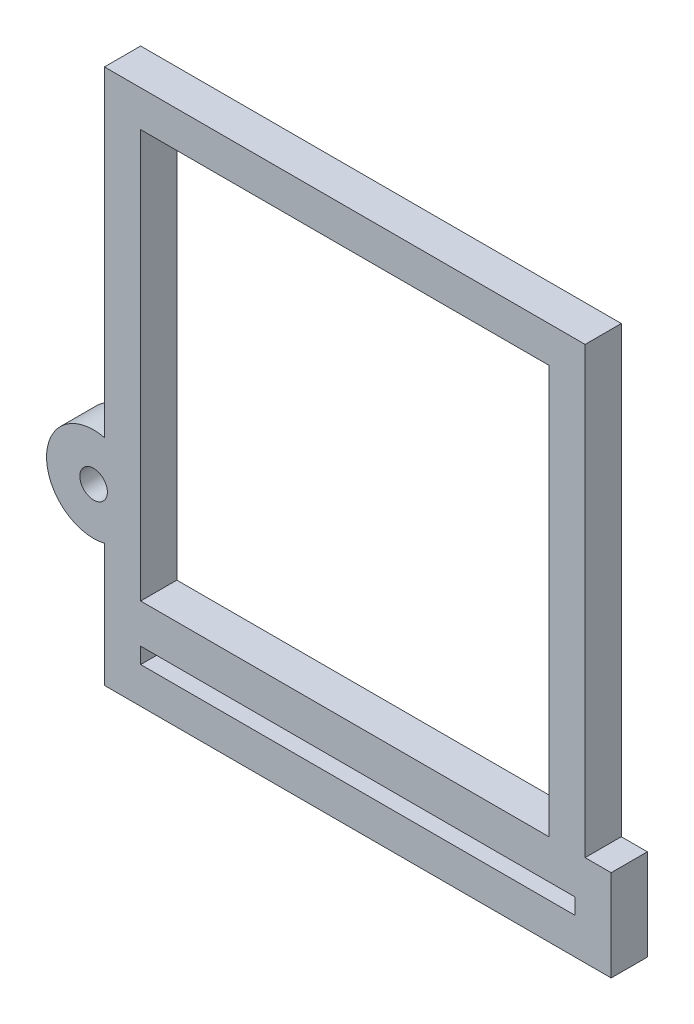
from build123d import *

# Parameters (mm, degrees)
SKETCH_1_W          = 70
SKETCH_1_H          = 74
EXTRUDE_1_DEPTH     = 5
CUT_EXTRUDE_2_REACH = 103.985
SKETCH_2_W          = 60
SKETCH_2_H          = 2.2
SKETCH_3_W          = 56.4
SKETCH_3_H          = 56.4
CUT_EXTRUDE_3_DEPTH = 20
SKETCH_4_W          = 3.6
SKETCH_4_H          = 61.4
CUT_EXTRUDE_5_DEPTH = 102.985293057
SKETCH_5_R          = 6.5
EXTRUDE_6_DEPTH     = 5
CUT_EXTRUDE_7_REACH = 103.985
SKETCH_6_R          = 1.9


with BuildPart() as part:
    # Эскиз1 → Вытянуть1 (new body)
    with BuildSketch(Plane.XY):
        with Locations((35, 37)):
            Rectangle(SKETCH_1_W, SKETCH_1_H)
    extrude(amount=EXTRUDE_1_DEPTH)

    # Эскиз2 → Вытянуть2 (cut, up to next)
    with BuildSketch(Plane.XY.offset(5), mode=Mode.PRIVATE) as cut_extrude_2_sk1:
        with Locations((35, 6.1)):
            Rectangle(SKETCH_2_W, SKETCH_2_H)
    cut_extrude_2_tool1 = extrude(cut_extrude_2_sk1.sketch, amount=-CUT_EXTRUDE_2_REACH, mode=Mode.PRIVATE) & part.part
    add(cut_extrude_2_tool1.solids().sort_by_distance((35, 6.1, 5))[0], mode=Mode.SUBTRACT)

    # Эскиз3 → Вытянуть3 (cut)
    with BuildSketch(Plane.XY.offset(5)):
        with Locations((33.2, 40.8)):
            Rectangle(SKETCH_3_W, SKETCH_3_H)
    extrude(amount=-CUT_EXTRUDE_3_DEPTH, mode=Mode.SUBTRACT)

    # Эскиз4 → Вытянуть5 (cut, through all)
    with BuildSketch(Plane(origin=(0, 0, 0), x_dir=(-1, 0, 0), z_dir=(0, 0, -1))):
        with Locations((-68.2, 43.3)):
            Rectangle(SKETCH_4_W, SKETCH_4_H)
    extrude(amount=-CUT_EXTRUDE_5_DEPTH, mode=Mode.SUBTRACT)

    # Эскиз5 → Вытянуть6 (add)
    with BuildSketch(Plane.XY.offset(5)):
        with Locations((-1.5, 23.329095616)):
            Circle(SKETCH_5_R)
    extrude(amount=-EXTRUDE_6_DEPTH)

    # Эскиз6 → Вытянуть7 (cut, up to next)
    with BuildSketch(Plane.XY.offset(5), mode=Mode.PRIVATE) as cut_extrude_7_sk1:
        with Locations((-1.5, 23.329095616)):
            Circle(SKETCH_6_R)
    cut_extrude_7_tool1 = extrude(cut_extrude_7_sk1.sketch, amount=-CUT_EXTRUDE_7_REACH, mode=Mode.PRIVATE) & part.part
    add(cut_extrude_7_tool1.solids().sort_by_distance((-1.5, 23.329096, 5))[0], mode=Mode.SUBTRACT)


solid = part.part
